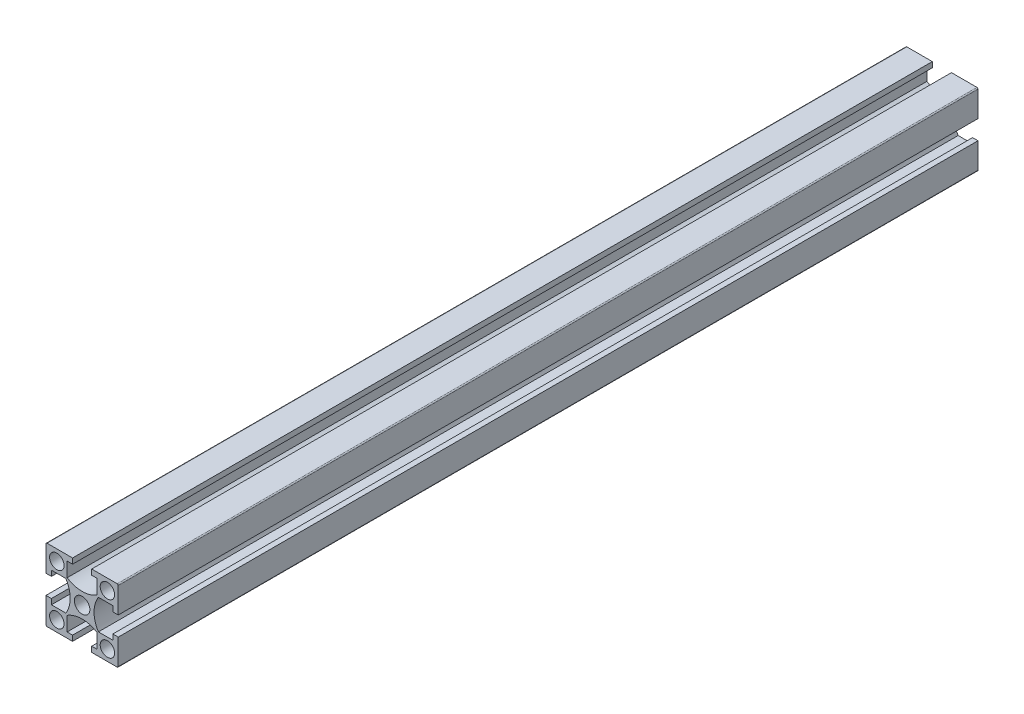
from build123d import *

# Parameters (mm, degrees)
SKETCH_1_W               = 20
SKETCH_1_H               = 20
SKETCH_1_R               = 2
SKETCH_1_R_2             = 2.15
EXTRUDE_1_DEPTH          = 238
CUT_EXTRUDE_1_REACH      = 240.42
PATTERN_CIRCULAR_1_COUNT = 4
FILLET_1_R               = 0.3
SKETCH_2_R               = 2.5
CUT_EXTRUDE_2_DEPTH      = 240.048112312
SKETCH_3_R               = 2.5
CUT_EXTRUDE_3_DEPTH      = 240.048112412


with BuildPart() as part:
    # 스케치1 → 보스-돌출1 (new body)
    with BuildSketch(Plane.XY):
        Rectangle(SKETCH_1_W, SKETCH_1_H)
        with Locations((-7, -7)):
            Circle(SKETCH_1_R, mode=Mode.SUBTRACT)
        with Locations((7, -7)):
            Circle(SKETCH_1_R, mode=Mode.SUBTRACT)
        with Locations((-7, 7)):
            Circle(SKETCH_1_R, mode=Mode.SUBTRACT)
        Circle(SKETCH_1_R_2, mode=Mode.SUBTRACT)
        with Locations((7, 7)):
            Circle(SKETCH_1_R, mode=Mode.SUBTRACT)
    extrude(amount=EXTRUDE_1_DEPTH)

    # 스케치1<3> → 컷-돌출1 (cut, up to next)
    with BuildSketch(Plane.XY, mode=Mode.PRIVATE) as cut_extrude_1_sk1:
        with BuildLine():
            Line((-8.5, 2.65), (-10, 2.65))
            Line((-10, 2.65), (-10, -2.65))
            Line((-10, -2.65), (-8.5, -2.65))
            Line((-8.5, -2.65), (-8.5, -4.15))
            Line((-8.5, -4.15), (-4.503166667, -4.15))
            ThreePointArc((-4.503166667, -4.15), (-3.3, 0), (-4.503166667, 4.15))
            Line((-4.503166667, 4.15), (-8.5, 4.15))
            Line((-8.5, 4.15), (-8.5, 2.65))
        make_face()
    cut_extrude_1_tool1 = extrude(cut_extrude_1_sk1.sketch, amount=CUT_EXTRUDE_1_REACH, mode=Mode.PRIVATE) & part.part
    cut_extrude_1 = cut_extrude_1_tool1.solids().sort_by_distance((-6.606913, 0, 0))[0]
    add(cut_extrude_1, mode=Mode.SUBTRACT)

    # 원형 패턴1: 컷-돌출1 ×4 about axis
    pattern_circular_1_axis = Axis((0, 0, 238), (0, 0, -1))
    for i in range(1, PATTERN_CIRCULAR_1_COUNT):
        add(cut_extrude_1.rotate(pattern_circular_1_axis, i * 360 / PATTERN_CIRCULAR_1_COUNT), mode=Mode.SUBTRACT)

    # 필렛1
    fillet_1_edges = [part.edges().sort_by_distance(p)[0] for p in [
        (10, -10, 119),
        (-10, -10, 119),
        (-10, 10, 119),
        (10, 10, 119),
    ]]
    fillet(fillet_1_edges, radius=FILLET_1_R)

    # 스케치2 → 컷-돌출2 (cut, through all)
    with BuildSketch(Plane.ZY.offset(10)):
        with Locations((11, 0)):
            Circle(SKETCH_2_R)
        with Locations((229, 0)):
            Circle(SKETCH_2_R)
    extrude(amount=-CUT_EXTRUDE_2_DEPTH, mode=Mode.SUBTRACT)

    # 스케치3 → 컷-돌출3 (cut, through all)
    with BuildSketch(Plane(origin=(0, 10, 0), x_dir=(1, 0, 0), z_dir=(0, 1, 0))):
        with Locations((0, -203)):
            Circle(SKETCH_3_R)
        with Locations((0, -161)):
            Circle(SKETCH_3_R)
    extrude(amount=-CUT_EXTRUDE_3_DEPTH, mode=Mode.SUBTRACT)


solid = part.part
